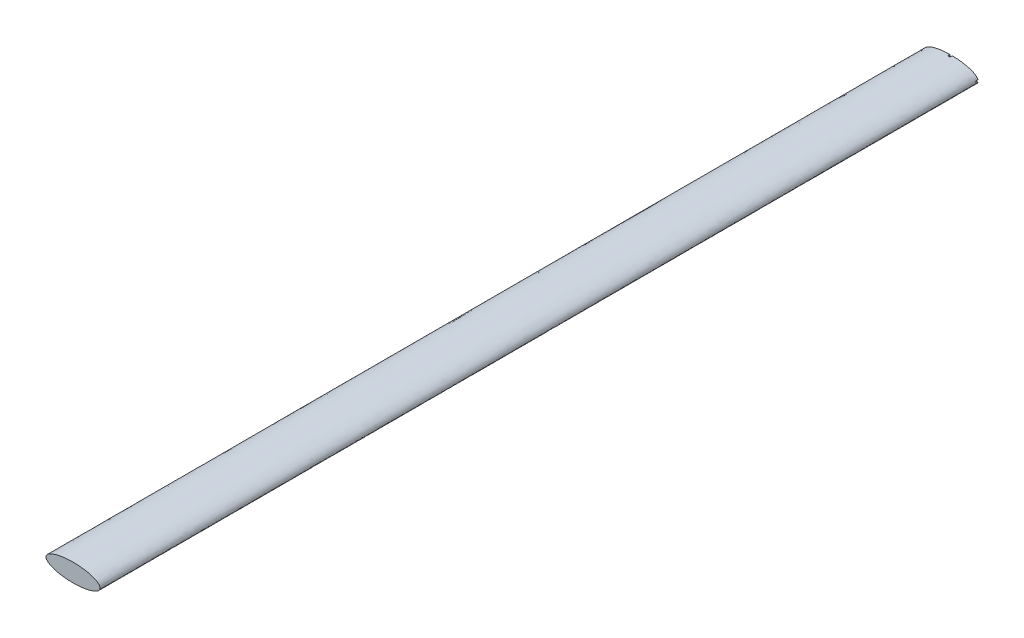
from build123d import *

# Parameters (mm, degrees)
ESQUISSE1_RX            = 12
ESQUISSE1_RY            = 4
BOSS_EXTRU_1_DEPTH      = 390
ENL_V_MAT_EXTRU_1_DEPTH = 1


with BuildPart() as part:
    # Esquisse1 → Boss.-Extru.1 (new body)
    with BuildSketch(Plane.XY):
        with Locations(Location((0, 0), (0, 0, 180))):
            Ellipse(ESQUISSE1_RX, ESQUISSE1_RY)
    extrude(amount=BOSS_EXTRU_1_DEPTH)

    # Esquisse2 → Enlèv. mat.-Extru.1 (cut)
    with BuildSketch(Plane(origin=(0, 0, 0), x_dir=(-1, 0, 0), z_dir=(0, 0, -1))):
        Polygon((0.5, -0.5), (0.5, -5.052696221), (-0.5, -5.052696221), (-0.5, -0.5), (-12.406324446, -0.5), (-12.406324446, 0.5), (-0.5, 0.5), (-0.5, 4.923496192), (0.5, 4.923496192), (0.5, 0.5), (12.27070909, 0.5), (12.27070909, -0.5), align=None)
    extrude(amount=-ENL_V_MAT_EXTRU_1_DEPTH, mode=Mode.SUBTRACT)


solid = part.part
